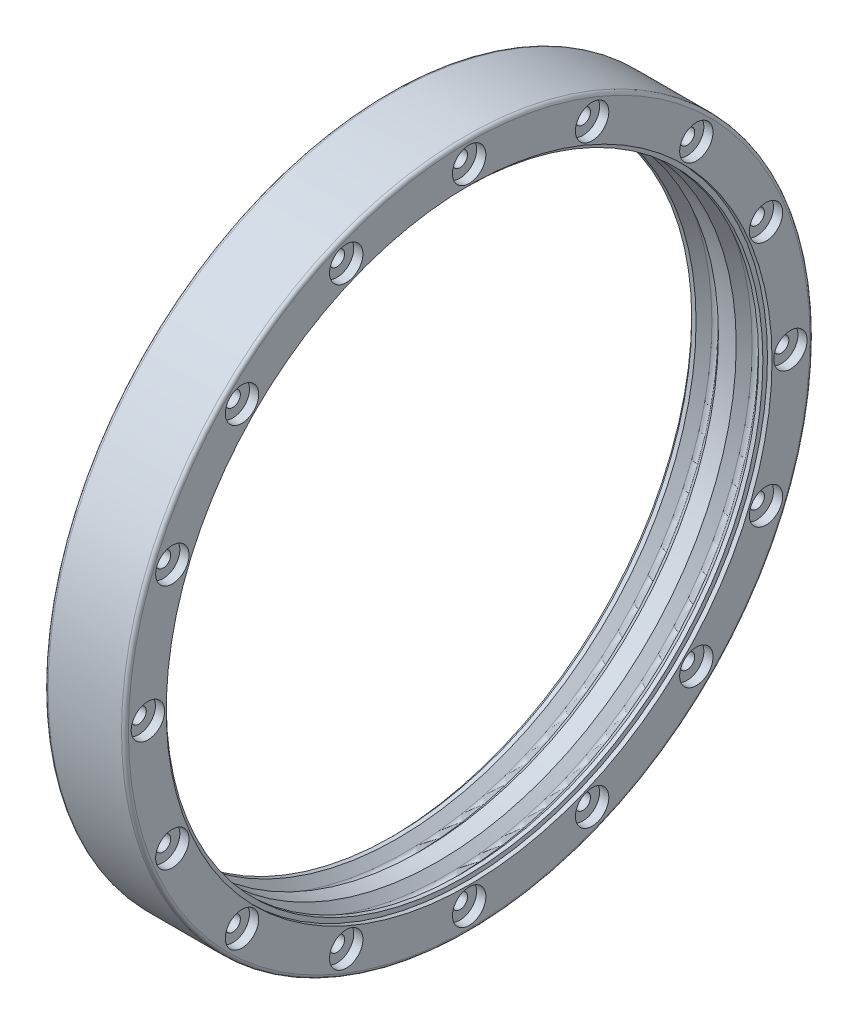
from build123d import *

# Parameters (mm, degrees)
FILLET1_R                               = 2
CBORE_FOR_M6_HEX_HEAD_BOLT1_D           = 6.6
CBORE_FOR_M6_HEX_HEAD_BOLT1_CBORE_D     = 14.547
CBORE_FOR_M6_HEX_HEAD_BOLT1_CBORE_DEPTH = 4
CIRPATTERN1_COUNT                       = 16
FILLET2_R                               = 1.5
SKETCH4_R                               = 132
SKETCH4_R_2                             = 130
CUT_EXTRUDE1_DEPTH                      = 2


with BuildPart() as part:
    # Sketch1 → Revolve1 (revolve)
    with BuildSketch(Plane.XY):
        Polygon((17.5, 150), (-17.5, 150), (-17.5, 130), (-13.613961031, 130), (-8.75, 134.863961031), (-3.886038969, 130), (3.886038969, 130), (8.75, 134.863961031), (13.613961031, 130), (17.5, 130), align=None)
    revolve(axis=Axis((0, 0, 0), (-1, 0, 0)))

    # Fillet1
    fillet1_edges = [part.edges().sort_by_distance(p)[0] for p in [
        (8.75, -134.863961031, 0),
        (-8.75, -134.863961031, 0),
    ]]
    fillet(fillet1_edges, radius=FILLET1_R)

    # CBORE for M6 Hex Head Bolt1 (through all)
    with Locations(Plane(origin=(17.5, 0, -140), x_dir=(0, 0, 1), z_dir=(1, 0, 0))):
        with Locations((0, 0)):
            cbore_for_m6_hex_head_bolt1 = CounterBoreHole(CBORE_FOR_M6_HEX_HEAD_BOLT1_D / 2, CBORE_FOR_M6_HEX_HEAD_BOLT1_CBORE_D / 2, CBORE_FOR_M6_HEX_HEAD_BOLT1_CBORE_DEPTH)

    # CirPattern1: CBORE for M6 Hex Head Bolt1 ×16 about axis
    cirpattern1_axis = Axis((-17.5, 0, 0), (1, 0, 0))
    for i in range(1, CIRPATTERN1_COUNT):
        add(cbore_for_m6_hex_head_bolt1.rotate(cirpattern1_axis, i * 360 / CIRPATTERN1_COUNT), mode=Mode.SUBTRACT)

    # Fillet2
    fillet2_edges = [part.edges().sort_by_distance(p)[0] for p in [
        (-17.5, -150, 0),
        (17.5, -150, 0),
    ]]
    fillet(fillet2_edges, radius=FILLET2_R)

    # Sketch4 → Cut-Extrude1 (cut)
    with BuildSketch(Plane(origin=(17.5, 0, 0), x_dir=(0, 0, -1), z_dir=(1, 0, 0))):
        Circle(SKETCH4_R)
        Circle(SKETCH4_R_2, mode=Mode.SUBTRACT)
    cut_extrude1 = extrude(amount=-CUT_EXTRUDE1_DEPTH, mode=Mode.SUBTRACT)

    # Mirror1: Cut-Extrude1 across plane
    add(cut_extrude1.mirror(Plane(origin=(0, 0, 0), x_dir=(0, 0, 1), z_dir=(1, 0, 0))), mode=Mode.SUBTRACT)


solid = part.part
